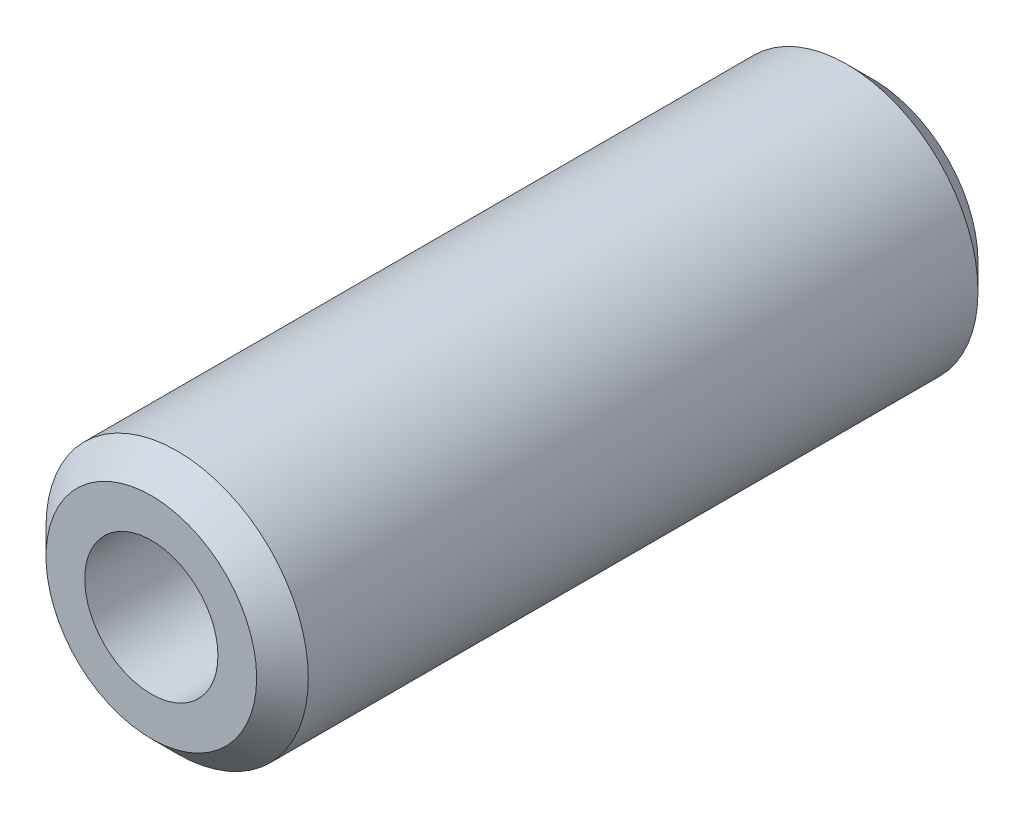
from build123d import *

# Parameters (mm, degrees)
SKETCH1_R           = 12.7
SKETCH1_R_2         = 6.45
BOSS_EXTRUDE1_DEPTH = 34.925
CHAMFER1_SIZE       = 2.5


with BuildPart() as part:
    # Sketch1 → Boss-Extrude1 (new, symmetric)
    with BuildSketch(Plane.XY):
        Circle(SKETCH1_R)
        Circle(SKETCH1_R_2, mode=Mode.SUBTRACT)
    extrude(amount=BOSS_EXTRUDE1_DEPTH, both=True)

    # Chamfer1
    chamfer1_edges = [part.edges().sort_by_distance(p)[0] for p in [
        (-12.7, 0, -34.925),
        (-12.7, 0, 34.925),
    ]]
    chamfer(chamfer1_edges, length=CHAMFER1_SIZE)


solid = part.part
